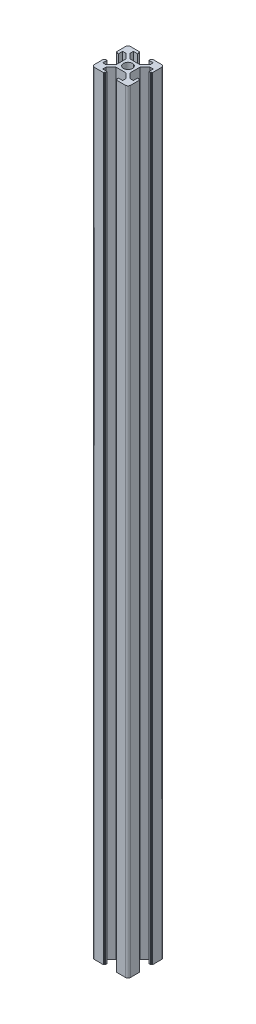
from build123d import *

# Parameters (mm, degrees)
SKETCH_2_R      = 2.5
EXTRUDE_1_DEPTH = 428


with BuildPart() as part:
    # 草图2 → 凸台-拉伸1 (new body)
    with BuildSketch(Plane(origin=(0, 0, 0), x_dir=(1, 0, 0), z_dir=(0, 1, 0))):
        with BuildLine():
            Line((-3.6, 10), (-3.6, 9.5))
            Line((-3.6, 9.5), (-3.1, 9.5))
            Line((-3.1, 9.5), (-3.1, 8.5))
            Line((-3.1, 8.5), (-5.5, 8.5))
            Line((-5.5, 8.5), (-5.5, 6.65))
            Line((-5.5, 6.65), (-2.75, 3.9))
            Line((-2.75, 3.9), (2.75, 3.9))
            Line((2.75, 3.9), (5.5, 6.65))
            Line((5.5, 6.65), (5.5, 8.5))
            Line((5.5, 8.5), (3.1, 8.5))
            Line((3.1, 8.5), (3.1, 9.5))
            Line((3.1, 9.5), (3.6, 9.5))
            Line((3.6, 9.5), (3.6, 10))
            Line((3.6, 10), (8.5, 10))
            ThreePointArc((8.5, 10), (9.560660172, 9.560660172), (10, 8.5))
            Line((10, 8.5), (10, 3.6))
            Line((10, 3.6), (9.5, 3.6))
            Line((9.5, 3.6), (9.5, 3.1))
            Line((9.5, 3.1), (8.5, 3.1))
            Line((8.5, 3.1), (8.5, 5.5))
            Line((8.5, 5.5), (6.65, 5.5))
            Line((6.65, 5.5), (3.9, 2.75))
            Line((3.9, 2.75), (3.9, -2.75))
            Line((3.9, -2.75), (6.65, -5.5))
            Line((6.65, -5.5), (8.5, -5.5))
            Line((8.5, -5.5), (8.5, -3.1))
            Line((8.5, -3.1), (9.5, -3.1))
            Line((9.5, -3.1), (9.5, -3.6))
            Line((9.5, -3.6), (10, -3.6))
            Line((10, -3.6), (10, -8.5))
            ThreePointArc((10, -8.5), (9.560660172, -9.560660172), (8.5, -10))
            Line((8.5, -10), (3.6, -10))
            Line((3.6, -10), (3.6, -9.5))
            Line((3.6, -9.5), (3.1, -9.5))
            Line((3.1, -9.5), (3.1, -8.5))
            Line((3.1, -8.5), (5.5, -8.5))
            Line((5.5, -8.5), (5.5, -6.65))
            Line((5.5, -6.65), (2.75, -3.9))
            Line((2.75, -3.9), (-2.75, -3.9))
            Line((-2.75, -3.9), (-5.5, -6.65))
            Line((-5.5, -6.65), (-5.5, -8.5))
            Line((-5.5, -8.5), (-3.1, -8.5))
            Line((-3.1, -8.5), (-3.1, -9.5))
            Line((-3.1, -9.5), (-3.6, -9.5))
            Line((-3.6, -9.5), (-3.6, -10))
            Line((-3.6, -10), (-8.5, -10))
            ThreePointArc((-8.5, -10), (-9.560660172, -9.560660172), (-10, -8.5))
            Line((-10, -8.5), (-10, -3.6))
            Line((-10, -3.6), (-9.5, -3.6))
            Line((-9.5, -3.6), (-9.5, -3.1))
            Line((-9.5, -3.1), (-8.5, -3.1))
            Line((-8.5, -3.1), (-8.5, -5.5))
            Line((-8.5, -5.5), (-6.65, -5.5))
            Line((-6.65, -5.5), (-3.9, -2.75))
            Line((-3.9, -2.75), (-3.9, 2.75))
            Line((-3.9, 2.75), (-6.65, 5.5))
            Line((-6.65, 5.5), (-8.5, 5.5))
            Line((-8.5, 5.5), (-8.5, 3.1))
            Line((-8.5, 3.1), (-9.5, 3.1))
            Line((-9.5, 3.1), (-9.5, 3.6))
            Line((-9.5, 3.6), (-10, 3.6))
            Line((-10, 3.6), (-10, 8.5))
            ThreePointArc((-10, 8.5), (-9.560660172, 9.560660172), (-8.5, 10))
            Line((-8.5, 10), (-3.6, 10))
        make_face()
        with Locations(Location((0, 0, 0), (0, 0, 270))):
            Circle(SKETCH_2_R, mode=Mode.SUBTRACT)
    extrude(amount=EXTRUDE_1_DEPTH)


solid = part.part
